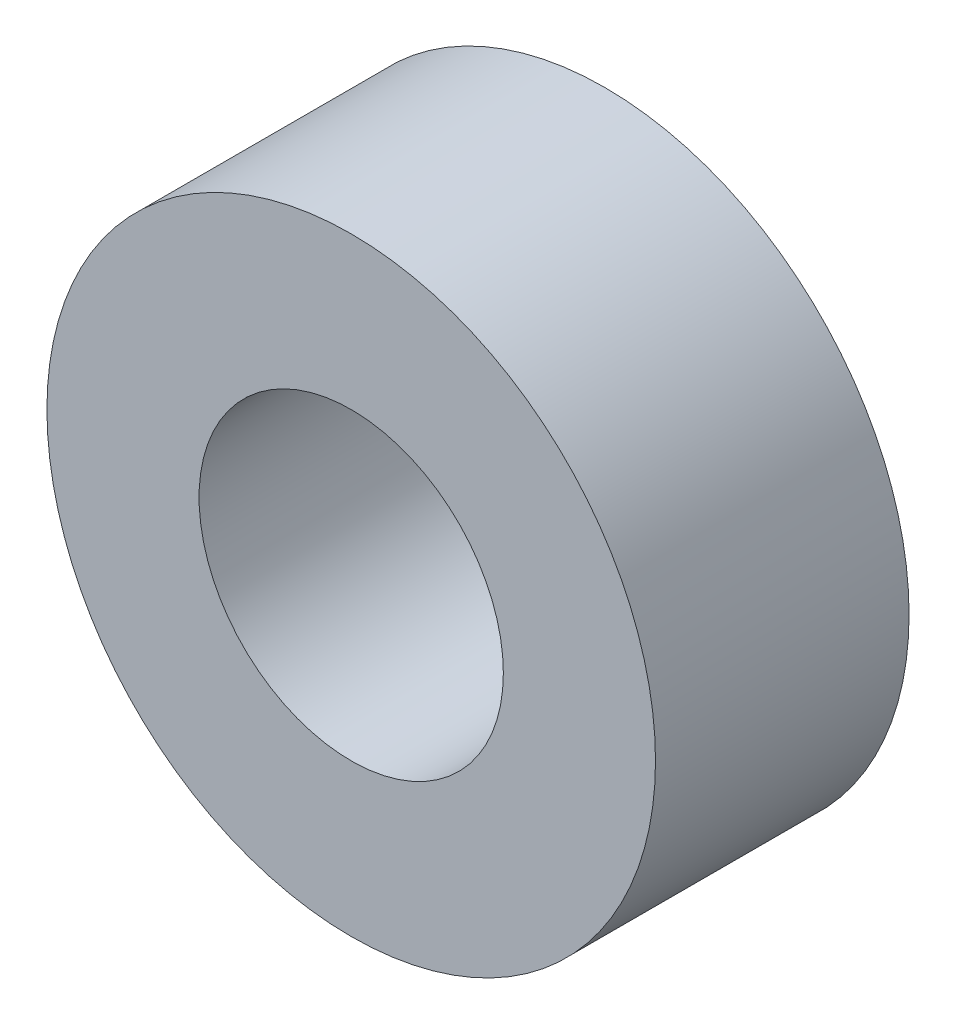
from build123d import *

# Parameters (mm, degrees)
SKETCH1_R           = 3
SKETCH1_R_2         = 1.5
BOSS_EXTRUDE1_DEPTH = 2.5


with BuildPart() as part:
    # Sketch1 → Boss-Extrude1 (new body)
    with BuildSketch(Plane.XY):
        Circle(SKETCH1_R)
        Circle(SKETCH1_R_2, mode=Mode.SUBTRACT)
    extrude(amount=-BOSS_EXTRUDE1_DEPTH)


solid = part.part
